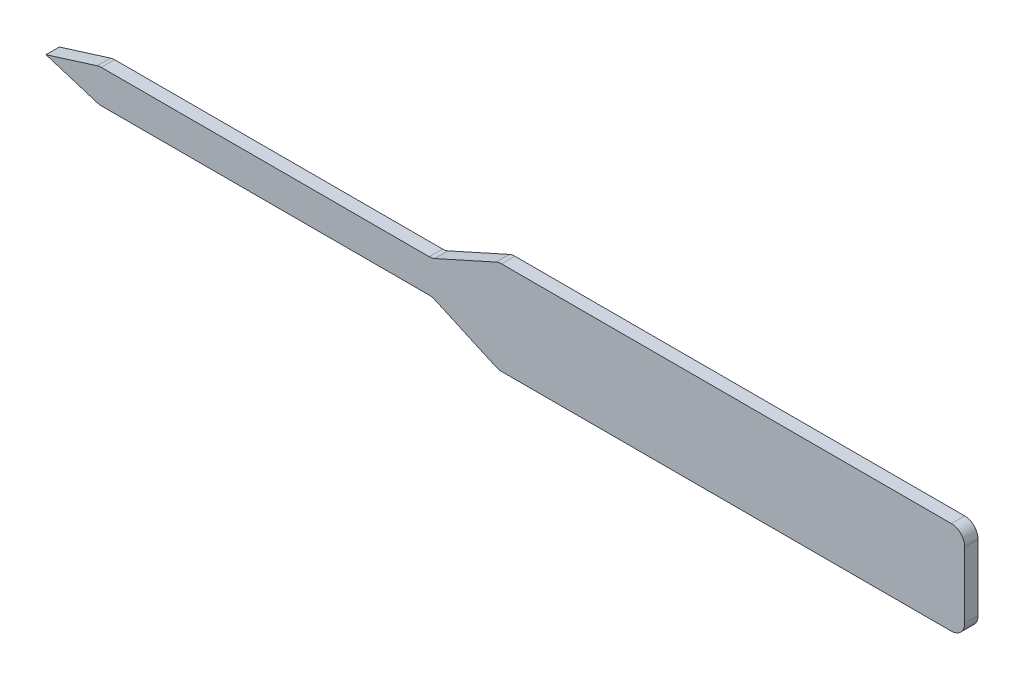
from build123d import *

# Parameters (mm, degrees)
BOSS_EXTRUDE1_DEPTH = 2
FILLET1_R           = 2


with BuildPart() as part:
    # Sketch1 → Boss-Extrude1 (new body)
    with BuildSketch(Plane.XY):
        Polygon((-35, 7), (-45, 2.5), (-95, 2.5), (-103, 0), (-95, -2.5), (-45, -2.5), (-35, -7), (35, -7), (35, 7), align=None)
    extrude(amount=BOSS_EXTRUDE1_DEPTH)

    # Fillet1
    fillet1_edges = [part.edges().sort_by_distance(p)[0] for p in [
        (35, -7, 1),
        (-35, -7, 1),
        (-45, -2.5, 1),
        (-95, -2.5, 1),
        (-95, 2.5, 1),
        (-45, 2.5, 1),
        (-35, 7, 1),
        (35, 7, 1),
    ]]
    fillet(fillet1_edges, radius=FILLET1_R)


solid = part.part
